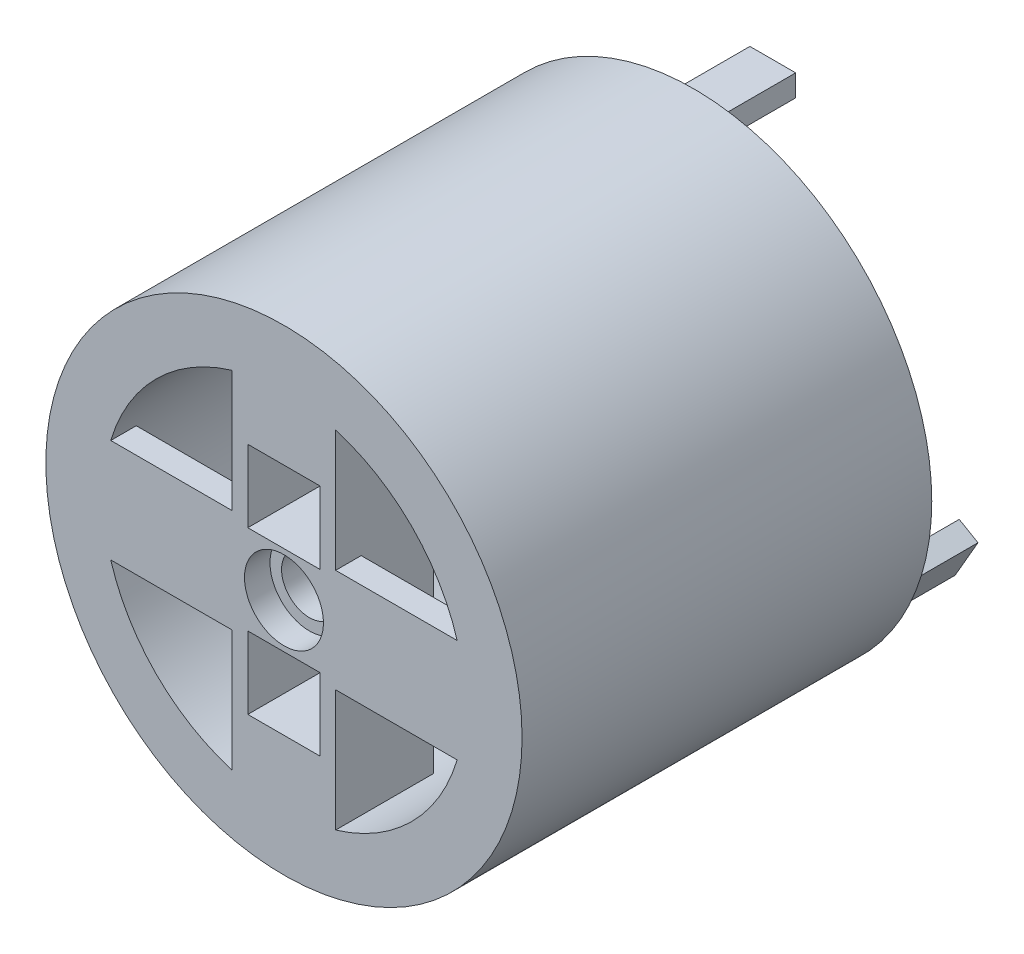
from build123d import *

# Parameters (mm, degrees)
SKETCH1_R                      = 29.64
SKETCH1_R_2                    = 22.5
BOSS_EXTRUDE1_DEPTH            = 51
SKETCH1_4_W                    = 5.7
SKETCH1_4_H                    = 2.7
BOSS_EXTRUDE2_DEPTH            = 9.85
CIRPATTERN2_COUNT              = 3
BOSS_EXTRUDE3_DEPTH            = 3.175
CUT_EXTRUDE2_REACH             = 75.89
SKETCH7_R                      = 4.9125
CUT_EXTRUDE2_DIRECTION_2_DEPTH = 74.890335633
SKETCH8_W                      = 12.873355566
SKETCH8_H                      = 48.17275248
SKETCH8_R                      = 3.475
BOSS_EXTRUDE4_DEPTH            = 9
SKETCH1_3_W                    = 4.8
SKETCH1_3_H                    = 9.8
CUT_EXTRUDE1_DEPTH             = 23
CIRPATTERN1_COUNT              = 6
SKETCH11_W                     = 9
SKETCH11_H                     = 9
CUT_EXTRUDE21_DEPTH            = 29


with BuildPart() as part:
    # Sketch1 → Boss-Extrude1 (new body)
    with BuildSketch(Plane.XY):
        Circle(SKETCH1_R)
        Circle(SKETCH1_R_2, mode=Mode.SUBTRACT)
    extrude(amount=BOSS_EXTRUDE1_DEPTH)

    # Sketch1<4> → Boss-Extrude2 (add)
    with BuildSketch(Plane.XY):
        with Locations((0, 26.5)):
            Rectangle(SKETCH1_4_W, SKETCH1_4_H)
    boss_extrude2 = extrude(amount=-BOSS_EXTRUDE2_DEPTH)

    # CirPattern2: Boss-Extrude2 ×3 about axis
    cirpattern2_axis = Axis((0, 0, 0), (0, 0, 1))
    for i in range(1, CIRPATTERN2_COUNT):
        add(boss_extrude2.rotate(cirpattern2_axis, i * 360 / CIRPATTERN2_COUNT))

    # Sketch4 → Boss-Extrude3 (add)
    with BuildSketch(Plane.XY.offset(51)):
        Polygon((-6.436677783, -24.214121516), (6.436677783, -24.214121516), (6.436677783, -6.436677783), (24.214121516, -6.436677783), (24.214121516, 6.436677783), (6.436677783, 6.436677783), (6.436677783, 24.214121516), (-6.436677783, 24.214121516), (-6.436677783, 6.436677783), (-24.214121516, 6.436677783), (-24.214121516, -6.436677783), (-6.436677783, -6.436677783), align=None)
    extrude(amount=-BOSS_EXTRUDE3_DEPTH)

    # Sketch7 → Cut-Extrude2 (cut, up to next)
    with BuildSketch(Plane.XY.offset(51), mode=Mode.PRIVATE) as cut_extrude2_sk1:
        with Locations(Location((0, 0, 0), (0, 0, 180))):
            Circle(SKETCH7_R)
    cut_extrude2_tool1 = extrude(cut_extrude2_sk1.sketch, amount=-CUT_EXTRUDE2_REACH, mode=Mode.PRIVATE) & part.part
    add(cut_extrude2_tool1.solids().sort_by_distance((0, 0, 51))[0], mode=Mode.SUBTRACT)

    # Sketch7 → Cut-Extrude2 direction 2 (cut)
    with BuildSketch(Plane.XY.offset(51)):
        with Locations(Location((0, 0, 0), (0, 0, 180))):
            Circle(SKETCH7_R)
    extrude(amount=CUT_EXTRUDE2_DIRECTION_2_DEPTH, mode=Mode.SUBTRACT)

    # Sketch8 → Boss-Extrude4 (add)
    with BuildSketch(Plane.XY.offset(47.825)):
        Rectangle(SKETCH8_W, SKETCH8_H)
        Circle(SKETCH8_R, mode=Mode.SUBTRACT)
    extrude(amount=-BOSS_EXTRUDE4_DEPTH)

    # Sketch1<3> → Cut-Extrude1 (cut)
    with BuildSketch(Plane.XY):
        with Locations((25.9, 0)):
            Rectangle(SKETCH1_3_W, SKETCH1_3_H)
    cut_extrude1 = extrude(amount=CUT_EXTRUDE1_DEPTH, mode=Mode.SUBTRACT)

    # CirPattern1: Cut-Extrude1 ×6 about axis
    cirpattern1_axis = Axis((0, 0, 0), (0, 0, 1))
    for i in range(1, CIRPATTERN1_COUNT):
        add(cut_extrude1.rotate(cirpattern1_axis, i * 360 / CIRPATTERN1_COUNT), mode=Mode.SUBTRACT)

    # Sketch11 → Cut-Extrude21 (cut)
    with BuildSketch(Plane(origin=(0, 0, 51), x_dir=(-1, 0, 0), z_dir=(0, 0, -1))):
        with Locations((0, 10.0625)):
            Rectangle(SKETCH11_W, SKETCH11_H)
    cut_extrude21 = extrude(amount=CUT_EXTRUDE21_DEPTH, mode=Mode.SUBTRACT)

    # Mirror1: Cut-Extrude21 across plane
    add(cut_extrude21.mirror(Plane.ZX), mode=Mode.SUBTRACT)


solid = part.part
